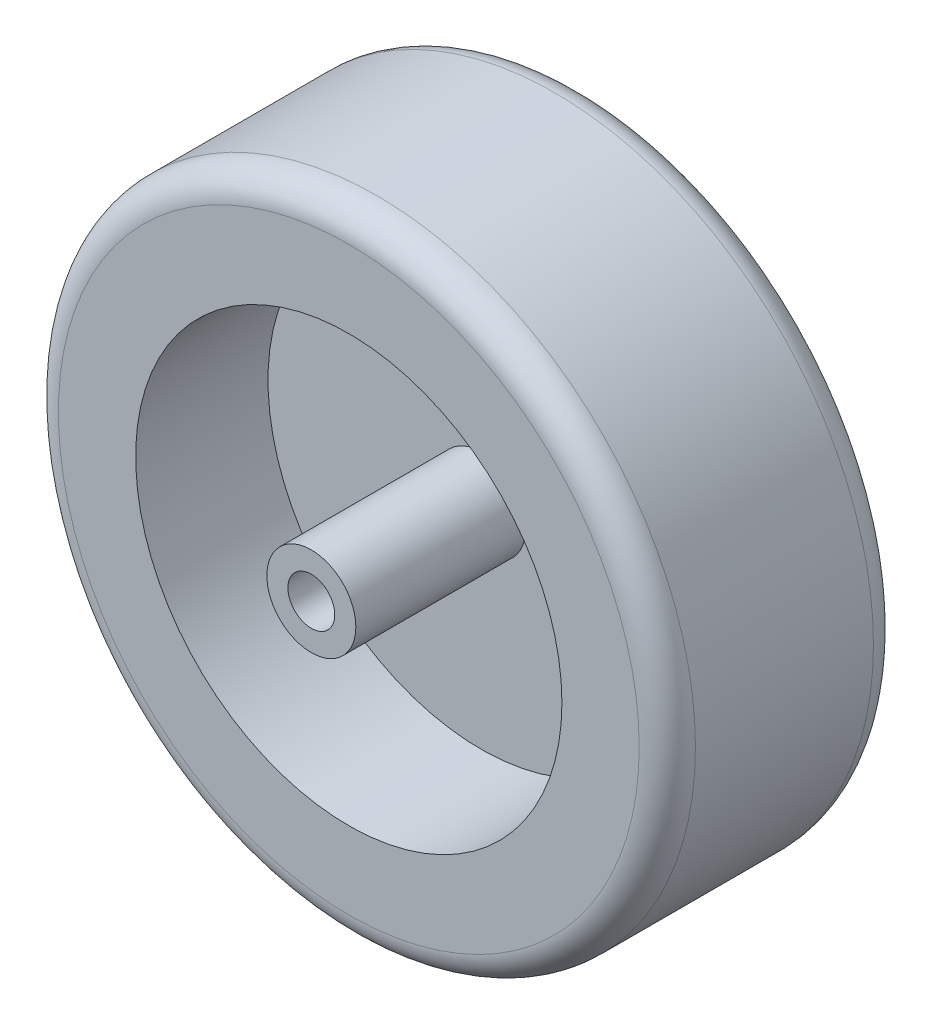
from build123d import *

# Parameters (mm, degrees)
FILLET1_R          = 3
SKETCH2_R          = 2.5
CUT_EXTRUDE1_DEPTH = 10


with BuildPart() as part:
    # Sketch1 → Revolve1 (revolve)
    with BuildSketch(Plane(origin=(0, 0, 0), x_dir=(1, 0, 0), z_dir=(0, 1, 0))):
        Polygon((0, 0), (0, 29), (34, 29), (34, 4), (22.75, 4), (22.75, 18.125), (4.75, 18.125), (4.75, 0), align=None)
    revolve(axis=Axis((0, 0, 0), (0, 0, -1)))

    # Fillet1
    fillet1_edges = [part.edges().sort_by_distance(p)[0] for p in [
        (-34, 0, -4),
        (-34, 0, -29),
    ]]
    fillet(fillet1_edges, radius=FILLET1_R)

    # Sketch2 → Cut-Extrude1 (cut)
    with BuildSketch(Plane.XY):
        Circle(SKETCH2_R)
    extrude(amount=-CUT_EXTRUDE1_DEPTH, mode=Mode.SUBTRACT)


solid = part.part
